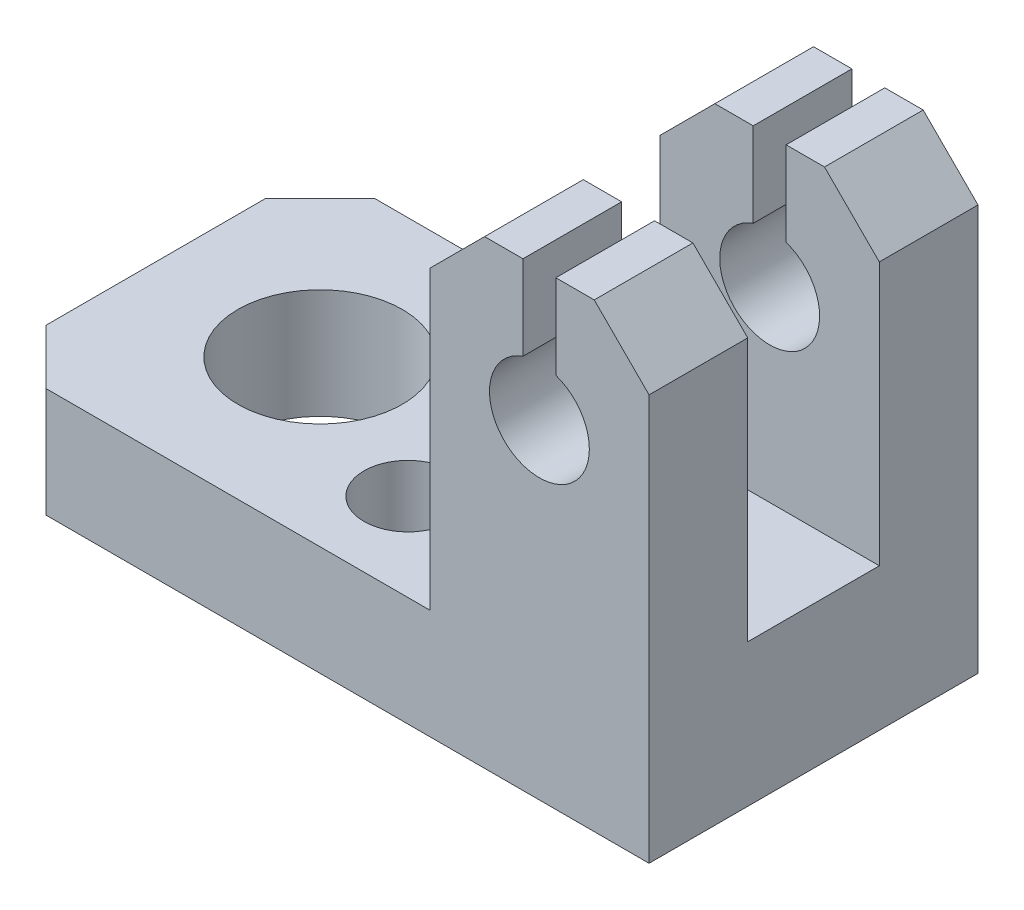
from build123d import *

# Parameters (mm, degrees)
BOSS_EXTRUDE1_DEPTH = 30
SKETCH2_R           = 7.5
SKETCH2_R_2         = 4
CUT_EXTRUDE1_DEPTH  = 75.323616704
SKETCH3_W           = 12
SKETCH3_H           = 29
CUT_EXTRUDE2_DEPTH  = 66.299310869
CHAMFER1_SIZE       = 5


with BuildPart() as part:
    # Sketch1 → Boss-Extrude1 (new body)
    with BuildSketch(Plane.XY):
        with BuildLine():
            ThreePointArc((-11.5, 34.299335699), (-10, 25.446508213), (-8.5, 34.299335699))
            Line((-8.5, 34.299335699), (-8.5, 42))
            Line((-8.5, 42), (0, 42))
            Line((0, 42), (0, 0))
            Line((0, 0), (-60, 0))
            Line((-60, 0), (-60, 10))
            Line((-60, 10), (-20, 10))
            Line((-20, 10), (-20, 42))
            Line((-20, 42), (-11.5, 42))
            Line((-11.5, 42), (-11.5, 34.299335699))
        make_face()
    extrude(amount=BOSS_EXTRUDE1_DEPTH)

    # Sketch2 → Cut-Extrude1 (cut, through all)
    with BuildSketch(Plane(origin=(0, 10, 0), x_dir=(1, 0, 0), z_dir=(0, 1, 0))):
        with Locations(Location((-45, -15, 0), (0, 0, 180))):
            Circle(SKETCH2_R)
        with Locations(Location((-30, -8, 0), (0, 0, 180))):
            Circle(SKETCH2_R_2)
        with Locations(Location((-30, -22, 0), (0, 0, 180))):
            Circle(SKETCH2_R_2)
    extrude(amount=-CUT_EXTRUDE1_DEPTH, mode=Mode.SUBTRACT)

    # Sketch3 → Cut-Extrude2 (cut, through all)
    with BuildSketch(Plane.ZY.offset(20)):
        with Locations((15, 27.5)):
            Rectangle(SKETCH3_W, SKETCH3_H)
    extrude(amount=-CUT_EXTRUDE2_DEPTH, mode=Mode.SUBTRACT)

    # Chamfer1
    chamfer1_edges = [part.edges().sort_by_distance(p)[0] for p in [
        (-60, 5, 0),
        (0, 42, 25.5),
        (-20, 42, 25.5),
        (-60, 5, 30),
        (0, 42, 4.5),
        (-20, 42, 4.5),
    ]]
    chamfer(chamfer1_edges, length=CHAMFER1_SIZE)


solid = part.part
